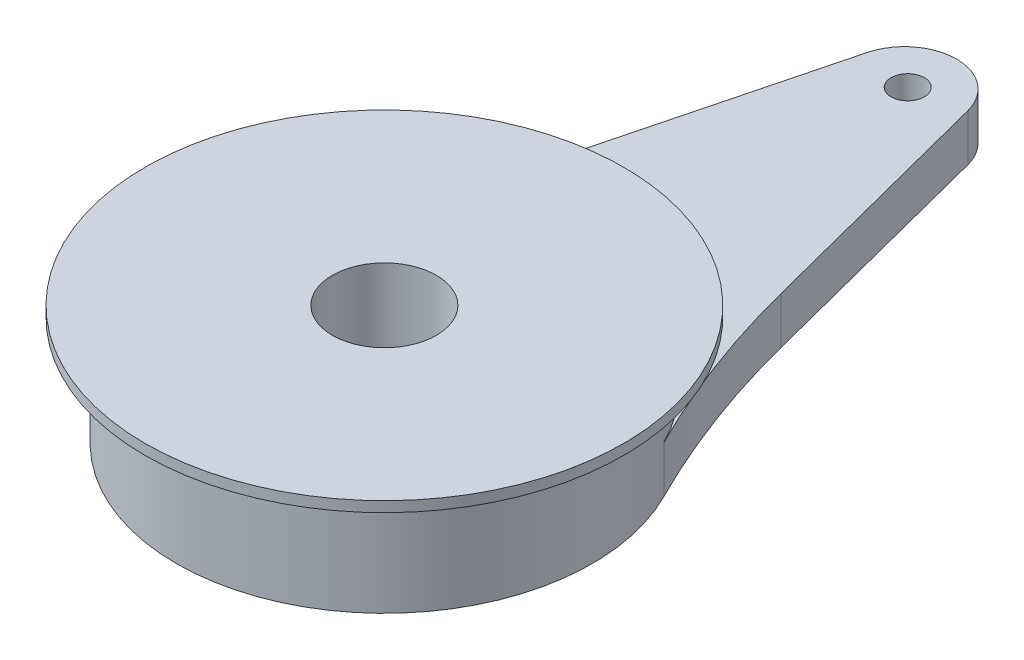
from build123d import *

# Parameters (mm, degrees)
SKETCH1_R           = 5
BOSS_EXTRUDE1_DEPTH = 4.5
CUT_EXTRUDE2_REACH  = 60.696
SKETCH3_R           = 1.6
SKETCH1_4_R         = 20
SKETCH1_4_R_2       = 5
BOSS_EXTRUDE2_DEPTH = 10.5
BOSS_EXTRUDE3_START = 10.5
SKETCH4_R           = 23
SKETCH4_R_2         = 5
BOSS_EXTRUDE3_DEPTH = 1
SKETCH2_R           = 13
CUT_EXTRUDE1_DEPTH  = 4


with BuildPart() as part:
    # Sketch1 → Boss-Extrude1 (new body)
    with BuildSketch(Plane(origin=(0, 0, 0), x_dir=(1, 0, 0), z_dir=(0, 1, 0))):
        with BuildLine():
            Line((-4.841786735, 51.247838615), (-11.080979808, 27.038904937))
            ThreePointArc((-11.080979808, 27.038904937), (-13.986571903, 17.837473452), (-17.860571099, 9))
            ThreePointArc((-17.860571099, 9), (0, -20), (17.860571099, 9))
            ThreePointArc((17.860571099, 9), (13.986571903, 17.837473452), (11.080979808, 27.038904937))
            Line((11.080979808, 27.038904937), (4.841786735, 51.247838615))
            ThreePointArc((4.841786735, 51.247838615), (0, 55), (-4.841786735, 51.247838615))
        make_face()
        with Locations(Location((0, 0, 0), (0, 0, 270))):
            Circle(SKETCH1_R, mode=Mode.SUBTRACT)
    extrude(amount=BOSS_EXTRUDE1_DEPTH)

    # Sketch3 → Cut-Extrude2 (cut, up to next)
    with BuildSketch(Plane(origin=(0, 0, 0), x_dir=(1, 0, 0), z_dir=(0, 1, 0)), mode=Mode.PRIVATE) as cut_extrude2_sk1:
        with Locations(Location((0, 50.305422276, 0), (0, 0, 270))):
            Circle(SKETCH3_R)
    cut_extrude2_tool1 = extrude(cut_extrude2_sk1.sketch, amount=CUT_EXTRUDE2_REACH, mode=Mode.PRIVATE) & part.part
    add(cut_extrude2_tool1.solids().sort_by_distance((0, 0, -50.305422))[0], mode=Mode.SUBTRACT)

    # Sketch1<4> → Boss-Extrude2 (add)
    with BuildSketch(Plane(origin=(0, 0, 0), x_dir=(1, 0, 0), z_dir=(0, 1, 0))):
        with Locations(Location((0, 0, 0), (0, 0, 26.74368395))):
            Circle(SKETCH1_4_R)
        with Locations(Location((0, 0, 0), (0, 0, 270))):
            Circle(SKETCH1_4_R_2, mode=Mode.SUBTRACT)
    extrude(amount=BOSS_EXTRUDE2_DEPTH)

    # Sketch4 → Boss-Extrude3 (add)
    with BuildSketch(Plane(origin=(0, 0, 0), x_dir=(1, 0, 0), z_dir=(0, 1, 0)).offset(BOSS_EXTRUDE3_START)):
        with Locations(Location((0, 0, 0), (0, 0, 270))):
            Circle(SKETCH4_R)
        with Locations(Location((0, 0, 0), (0, 0, 270))):
            Circle(SKETCH4_R_2, mode=Mode.SUBTRACT)
    extrude(amount=BOSS_EXTRUDE3_DEPTH)

    # Sketch2 → Cut-Extrude1 (cut)
    with BuildSketch(Plane(origin=(0, 0, 0), x_dir=(1, 0, 0), z_dir=(0, 1, 0))):
        with Locations(Location((0, 0, 0), (0, 0, 270))):
            Circle(SKETCH2_R)
    extrude(amount=CUT_EXTRUDE1_DEPTH, mode=Mode.SUBTRACT)


solid = part.part
